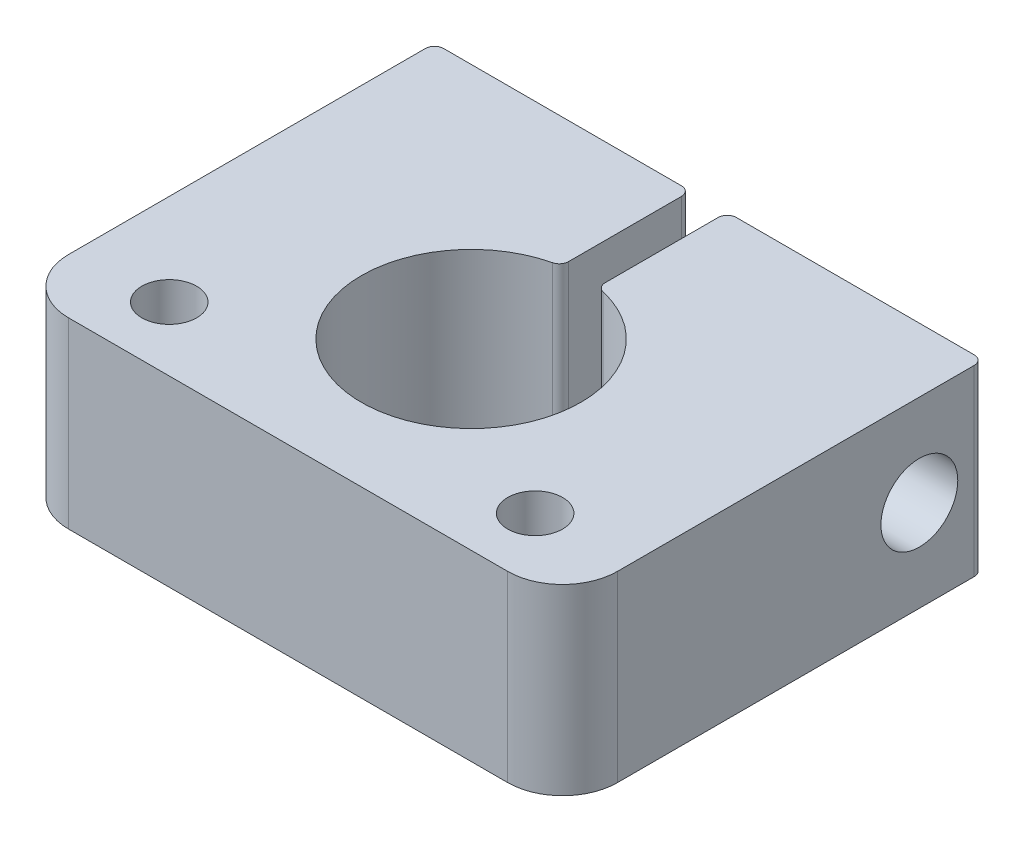
from build123d import *

# Parameters (mm, degrees)
SKETCH1_W           = 30
SKETCH1_H           = 23
SKETCH1_R           = 6
SKETCH1_R_2         = 1.5
BOSS_EXTRUDE1_DEPTH = 10
SKETCH2_W           = 2
SKETCH2_H           = 15
CUT_EXTRUDE1_DEPTH  = 10
CUT_EXTRUDE2_REACH  = 41.102
SKETCH3_R           = 2.1
SKETCH4_R           = 1.25
CUT_EXTRUDE3_DEPTH  = 20
FILLET1_R           = 3
FILLET2_R           = 0.5


with BuildPart() as part:
    # Sketch1 → Boss-Extrude1 (new body)
    with BuildSketch(Plane(origin=(0, 0, 0), x_dir=(1, 0, 0), z_dir=(0, 1, 0))):
        with Locations((15, -11.5)):
            Rectangle(SKETCH1_W, SKETCH1_H)
        with Locations(Location((15, -13, 0), (0, 0, 270))):
            Circle(SKETCH1_R, mode=Mode.SUBTRACT)
        with Locations(Location((5, -19.5, 0), (0, 0, 270))):
            Circle(SKETCH1_R_2, mode=Mode.SUBTRACT)
        with Locations(Location((25, -19.5, 0), (0, 0, 270))):
            Circle(SKETCH1_R_2, mode=Mode.SUBTRACT)
    extrude(amount=BOSS_EXTRUDE1_DEPTH)

    # Sketch2 → Cut-Extrude1 (cut)
    with BuildSketch(Plane(origin=(0, 10, 0), x_dir=(1, 0, 0), z_dir=(0, 1, 0))):
        with Locations((15, -4.5)):
            Rectangle(SKETCH2_W, SKETCH2_H)
    extrude(amount=-CUT_EXTRUDE1_DEPTH, mode=Mode.SUBTRACT)

    # Sketch3 → Cut-Extrude2 (cut, up to next)
    with BuildSketch(Plane(origin=(30, 0, 0), x_dir=(0, 0, -1), z_dir=(1, 0, 0)), mode=Mode.PRIVATE) as cut_extrude2_sk1:
        with Locations((-3.5, 5)):
            Circle(SKETCH3_R)
    cut_extrude2_tool1 = extrude(cut_extrude2_sk1.sketch, amount=-CUT_EXTRUDE2_REACH, mode=Mode.PRIVATE) & part.part
    add(cut_extrude2_tool1.solids().sort_by_distance((30, 5, 3.5))[0], mode=Mode.SUBTRACT)

    # Sketch4 → Cut-Extrude3 (cut)
    with BuildSketch(Plane(origin=(14, 0, 0), x_dir=(0, 0, -1), z_dir=(1, 0, 0))):
        with Locations((-3.5, 5)):
            Circle(SKETCH4_R)
    extrude(amount=-CUT_EXTRUDE3_DEPTH, mode=Mode.SUBTRACT)

    # Fillet1
    fillet1_edges = [part.edges().sort_by_distance(p)[0] for p in [
        (30, 5, 23),
        (0, 5, 23),
    ]]
    fillet(fillet1_edges, radius=FILLET1_R)

    # Fillet2
    fillet2_edges = [part.edges().sort_by_distance(p)[0] for p in [
        (14, 5, 7.083920217),
        (16, 5, 7.083920217),
        (16, 5, 0),
        (14, 5, 0),
        (0, 5, 0),
        (30, 5, 0),
    ]]
    fillet(fillet2_edges, radius=FILLET2_R)


solid = part.part
